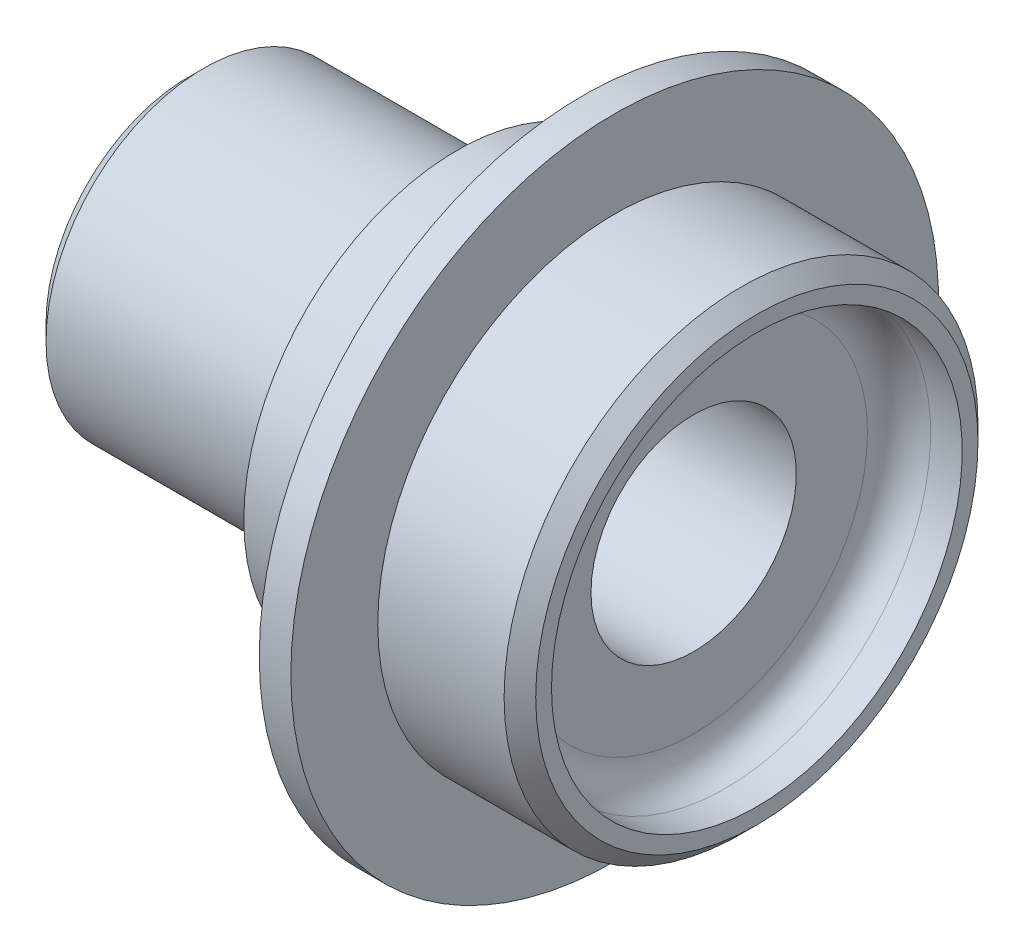
from build123d import *

# Parameters (mm, degrees)
CHAMFER1_SIZE = 1


with BuildPart() as part:
    # Sketch2 → Revolve1 (revolve)
    with BuildSketch(Plane.XY, mode=Mode.PRIVATE) as revolve1_sk:
        with BuildLine():
            Line((0, 8), (0, 10))
            Line((0, 10), (15, 10))
            Line((15, 10), (17.020725942, 13.5))
            Line((17.020725942, 13.5), (25, 13.5))
            Line((25, 13.5), (25, 20.5))
            Line((25, 20.5), (27, 20.5))
            Line((27, 20.5), (27, 15))
            Line((27, 15), (36, 15))
            Line((36, 15), (36, 13))
            Line((36, 13), (34, 13))
            ThreePointArc((34, 13), (32.585786438, 12.414213562), (32, 11))
            Line((32, 11), (32, 6.5))
            Line((32, 6.5), (12, 6.5))
            Line((12, 6.5), (12, 5.5))
            Line((12, 5.5), (10, 5.5))
            Line((10, 5.5), (10, 8))
            Line((10, 8), (0, 8))
        make_face()
    revolve(revolve1_sk.sketch.rotate(Axis((0, 0, 0), (1, 0, 0)), 90), axis=Axis((0, 0, 0), (1, 0, 0)))

    # Chamfer1
    chamfer1_edges = [part.edges().sort_by_distance(p)[0] for p in [
        (0, 0, -10),
        (36, 0, -15),
    ]]
    chamfer(chamfer1_edges, length=CHAMFER1_SIZE)


solid = part.part
